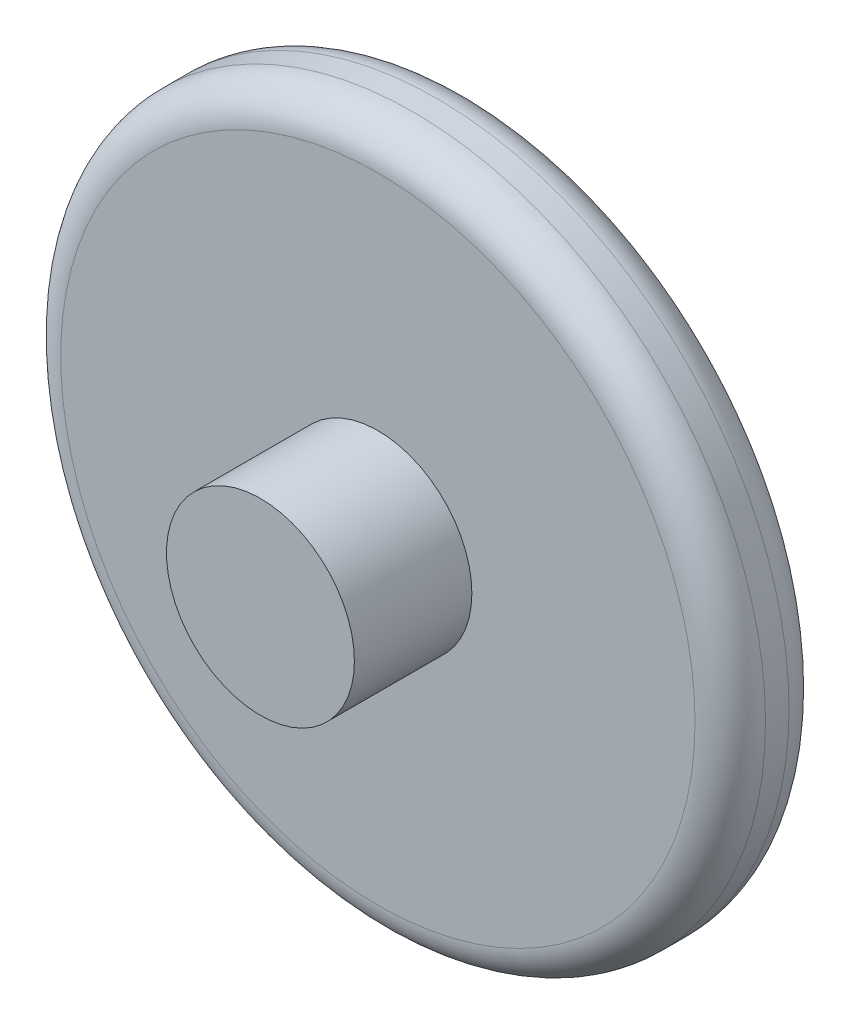
from build123d import *

# Parameters (mm, degrees)
CROQUIS1_R              = 30
SALIENTE_EXTRUIR1_DEPTH = 8
CROQUIS2_R              = 8
SALIENTE_EXTRUIR2_DEPTH = 10
REDONDEO1_R             = 3


with BuildPart() as part:
    # Croquis1 → Saliente-Extruir1 (new body)
    with BuildSketch(Plane.XY):
        Circle(CROQUIS1_R)
    extrude(amount=SALIENTE_EXTRUIR1_DEPTH)

    # Croquis2 → Saliente-Extruir2 (add)
    with BuildSketch(Plane.XY.offset(8)):
        Circle(CROQUIS2_R)
    extrude(amount=SALIENTE_EXTRUIR2_DEPTH)

    # Redondeo1
    redondeo1_edges = [part.edges().sort_by_distance(p)[0] for p in [
        (-30, 0, 0),
        (-30, 0, 8),
    ]]
    fillet(redondeo1_edges, radius=REDONDEO1_R)


solid = part.part
